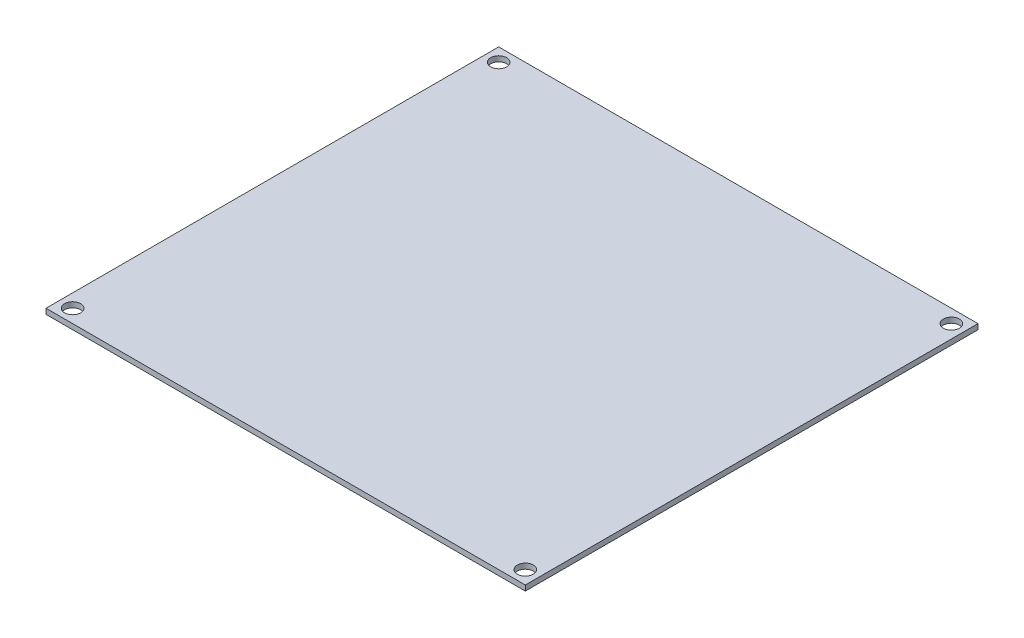
from build123d import *

# Parameters (mm, degrees)
SKETCH1_W           = 180
SKETCH1_H           = 170
SKETCH1_R           = 3
BOSS_EXTRUDE1_DEPTH = 2


with BuildPart() as part:
    # Sketch1 → Boss-Extrude1 (new body)
    with BuildSketch(Plane(origin=(0, 0, 0), x_dir=(1, 0, 0), z_dir=(0, 1, 0))):
        Rectangle(SKETCH1_W, SKETCH1_H)
        with Locations(Location((-85, -80, 0), (0, 0, 270))):
            Circle(SKETCH1_R, mode=Mode.SUBTRACT)
        with Locations(Location((85, -80, 0), (0, 0, 90))):
            Circle(SKETCH1_R, mode=Mode.SUBTRACT)
        with Locations(Location((-85, 80, 0), (0, 0, 270))):
            Circle(SKETCH1_R, mode=Mode.SUBTRACT)
        with Locations(Location((85, 80, 0), (0, 0, 90))):
            Circle(SKETCH1_R, mode=Mode.SUBTRACT)
    extrude(amount=BOSS_EXTRUDE1_DEPTH)


solid = part.part
